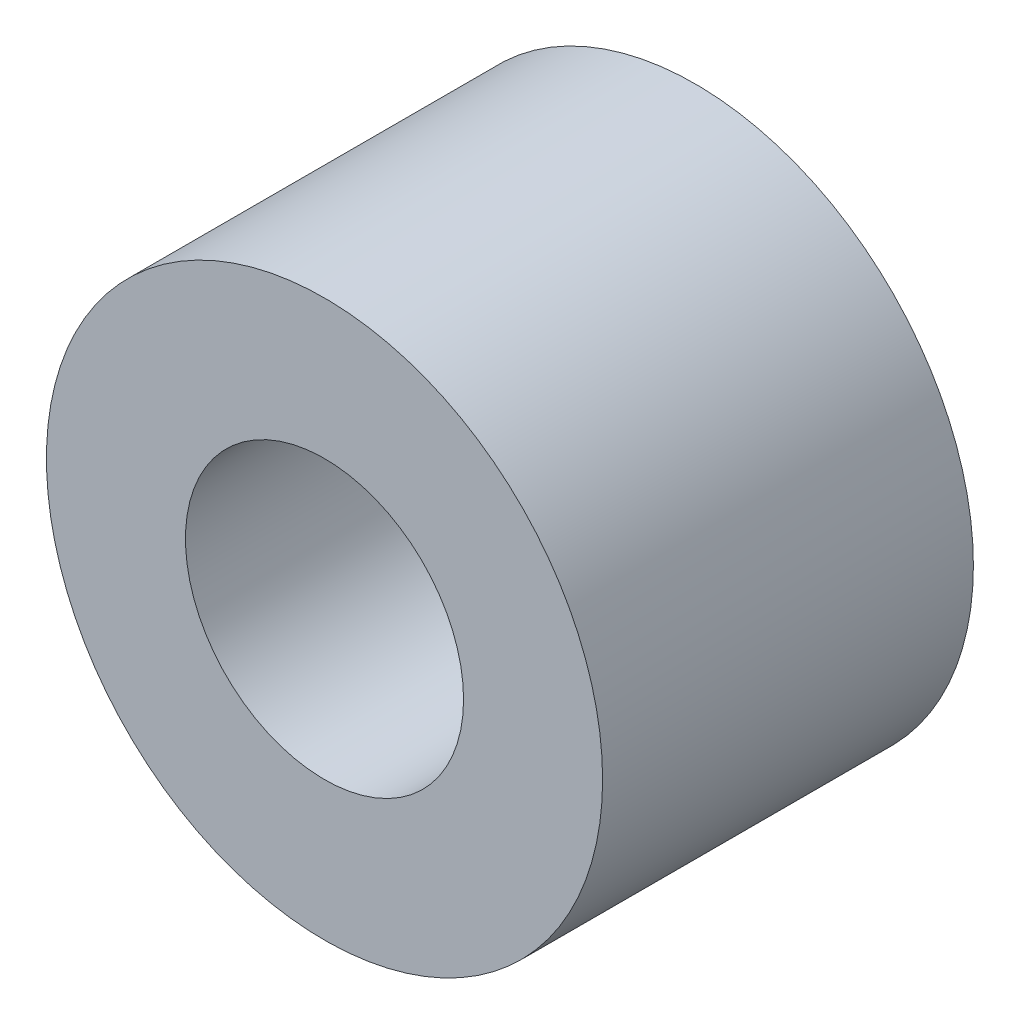
from build123d import *

# Parameters (mm, degrees)
SKETCH_2_R      = 3
SKETCH_2_R_2    = 1.5
EXTRUDE_1_DEPTH = 4


with BuildPart() as part:
    # 草图2 → 凸台-拉伸1 (new body)
    with BuildSketch(Plane.XY):
        with Locations((-80, 0.003)):
            Circle(SKETCH_2_R)
        with Locations((-80, 0.003)):
            Circle(SKETCH_2_R_2, mode=Mode.SUBTRACT)
    extrude(amount=EXTRUDE_1_DEPTH)


solid = part.part
